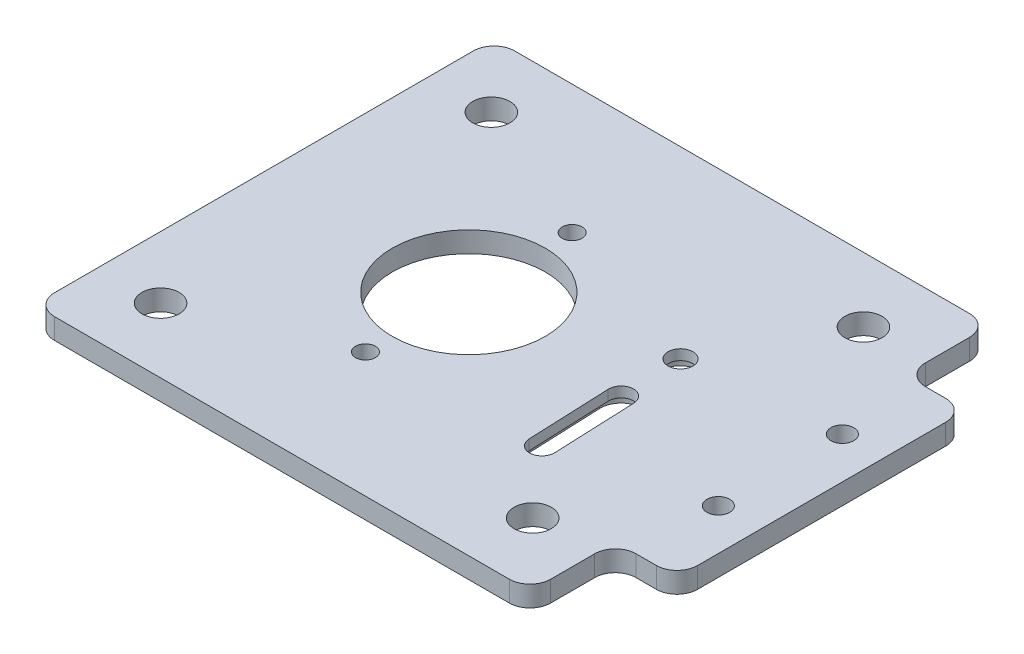
from build123d import *

# Parameters (mm, degrees)
SKETCH1_W            = 230
SKETCH1_H            = 200
BOSS_EXTRUDE1_DEPTH  = 5
SKETCH2_R            = 15
SKETCH2_R_2          = 14
SKETCH2_R_3          = 10
SKETCH2_R_4          = 18.5
SKETCH2_R_5          = 3
CUT_EXTRUDE1_DEPTH   = 305.836021494
M4_CLEARANCE_HOLE1_D = 4.8
SKETCH5_W            = 20
SKETCH5_H            = 5
CUT_EXTRUDE2_DEPTH   = 305.836021494
SKETCH8_W            = 230
SKETCH8_H            = 89.8
CUT_EXTRUDE4_DEPTH   = 305.836021494
SKETCH16_W           = 120
SKETCH16_H           = 1.1
BOSS_EXTRUDE2_DEPTH  = 5
M8_CLEARANCE_HOLE1_D = 9
CUT_EXTRUDE7_DEPTH   = 306.558848669
M5_CLEARANCE_HOLE2_D = 5.5
FILLET3_R            = 30
SKETCH22_W           = 97.742742711
SKETCH22_H           = 151.745417032
CUT_EXTRUDE8_DEPTH   = 281.162827656
SKETCH23_R           = 5
CUT_EXTRUDE9_DEPTH   = 2.5
FILLET4_R            = 5


with BuildPart() as part:
    # Sketch1 → Boss-Extrude1 (new body)
    with BuildSketch(Plane(origin=(0, 0, 0), x_dir=(1, 0, 0), z_dir=(0, 1, 0))):
        with Locations((115, 100)):
            Rectangle(SKETCH1_W, SKETCH1_H)
    extrude(amount=BOSS_EXTRUDE1_DEPTH)

    # Sketch2 → Cut-Extrude1 (cut, through all)
    with BuildSketch(Plane(origin=(0, 5, 0), x_dir=(1, 0, 0), z_dir=(0, 1, 0))):
        with Locations(Location((50, 60, 0), (0, 0, 270))):
            Circle(SKETCH2_R)
        with Locations(Location((168.717100706, 42.5, 0), (0, 0, 270))):
            Circle(SKETCH2_R_2)
        with Locations(Location((169.895788083, 150, 0), (0, 0, 90))):
            Circle(SKETCH2_R_3)
        with Locations(Location((50, 145, 0), (0, 0, 90))):
            Circle(SKETCH2_R_4)
        with Locations(Location((89.548596028, 156.65798234, 0), (0, 0, 270))):
            Circle(SKETCH2_R_5)
        with BuildLine():
            Line((104.360743639, 72.202850118), (98.527410306, 32.630483216))
            ThreePointArc((98.527410306, 32.630483216), (96.257125294, 30.943531537), (94.570173616, 33.213816549))
            Line((94.570173616, 33.213816549), (100.403506949, 72.786183451))
            ThreePointArc((100.403506949, 72.786183451), (102.673791961, 74.473135129), (104.360743639, 72.202850118))
        make_face()
        with BuildLine():
            Line((94.004324063, 121.813377483), (93.17099073, 141.79600883))
            ThreePointArc((93.17099073, 141.79600883), (90.048596028, 144.668403532), (87.176201326, 141.54600883))
            Line((87.176201326, 141.54600883), (88.009534659, 121.563377483))
            ThreePointArc((88.009534659, 121.563377483), (91.131929361, 118.690982781), (94.004324063, 121.813377483))
        make_face()
    extrude(amount=-CUT_EXTRUDE1_DEPTH, mode=Mode.SUBTRACT)

    # M4 Clearance Hole1 (through all)
    with Locations(Plane(origin=(0, 5, 0), x_dir=(1, 0, 0), z_dir=(0, 1, 0))):
        with Locations((50, 120), (50, 32.5), (168.717100706, 61), (168.717100706, 24), (187.217100706, 42.5), (150.217100706, 42.5), (50, 170)):
            Hole(M4_CLEARANCE_HOLE1_D / 2)

    # Sketch5 → Cut-Extrude2 (cut, through all)
    with BuildSketch(Plane(origin=(0, 5, 0), x_dir=(1, 0, 0), z_dir=(0, 1, 0))):
        with Locations((30, 7.5)):
            Rectangle(SKETCH5_W, SKETCH5_H)
        with Locations((70, 7.5)):
            Rectangle(SKETCH5_W, SKETCH5_H)
        with Locations((110, 7.5)):
            Rectangle(SKETCH5_W, SKETCH5_H)
        with Locations((150, 7.5)):
            Rectangle(SKETCH5_W, SKETCH5_H)
        with Locations((190, 7.5)):
            Rectangle(SKETCH5_W, SKETCH5_H)
    extrude(amount=-CUT_EXTRUDE2_DEPTH, mode=Mode.SUBTRACT)

    # Sketch8 → Cut-Extrude4 (cut, through all)
    with BuildSketch(Plane(origin=(0, 5, 0), x_dir=(1, 0, 0), z_dir=(0, 1, 0))):
        with Locations((115, 44.9)):
            Rectangle(SKETCH8_W, SKETCH8_H)
    extrude(amount=-CUT_EXTRUDE4_DEPTH, mode=Mode.SUBTRACT)

    # Sketch16 → Boss-Extrude2 (add)
    with BuildSketch(Plane(origin=(0, 5, 0), x_dir=(1, 0, 0), z_dir=(0, 1, 0))):
        with Locations((60, 200.55)):
            Rectangle(SKETCH16_W, SKETCH16_H)
    extrude(amount=-BOSS_EXTRUDE2_DEPTH)

    # M8 Clearance Hole1 (through all)
    with Locations(Plane(origin=(0, 5, 0), x_dir=(1, 0, 0), z_dir=(0, 1, 0))):
        with Locations((15, 185.45), (15, 105.45), (105, 105.45), (105, 185.45)):
            Hole(M8_CLEARANCE_HOLE1_D / 2)

    # Sketch18 → Cut-Extrude7 (cut, through all)
    with BuildSketch(Plane(origin=(0, 5, 0), x_dir=(1, 0, 0), z_dir=(0, 1, 0))):
        Polygon((120, 225.92357398), (254.211620271, 225.92357398), (254.211620271, 61.332744885), (120, 61.332744885), (120, 110.45), (195, 110.45), (195, 180.45), (120, 180.45), align=None)
    extrude(amount=-CUT_EXTRUDE7_DEPTH, mode=Mode.SUBTRACT)

    # M5 Clearance Hole2 (through all)
    with Locations(Plane(origin=(0, 5, 0), x_dir=(1, 0, 0), z_dir=(0, 1, 0))):
        with Locations((124.9, 160.45), (124.9, 130.45)):
            Hole(M5_CLEARANCE_HOLE2_D / 2)

    # Fillet3
    fillet3_edges = [part.edges().sort_by_distance(p)[0] for p in [
        (195, 2.5, -110.45),
        (195, 2.5, -180.45),
    ]]
    fillet(fillet3_edges, radius=FILLET3_R)

    # Sketch22 → Cut-Extrude8 (cut, through all)
    with BuildSketch(Plane(origin=(0, 5, 0), x_dir=(1, 0, 0), z_dir=(0, 1, 0))):
        with Locations((183.771371356, 144.05197651)):
            Rectangle(SKETCH22_W, SKETCH22_H)
    extrude(amount=-CUT_EXTRUDE8_DEPTH, mode=Mode.SUBTRACT)

    # Sketch23 → Cut-Extrude9 (cut)
    with BuildSketch(Plane.XZ):
        with Locations(Location((89.548596028, -156.65798234, 0), (0, 0, 270))):
            Circle(SKETCH23_R)
        with BuildLine():
            Line((95.169253864, -141.879342163), (96.002587198, -121.896710816))
            ThreePointArc((96.002587198, -121.896710816), (91.215262694, -116.692719646), (86.011271524, -121.480044149))
            Line((86.011271524, -121.480044149), (85.177938191, -141.462675497))
            ThreePointArc((85.177938191, -141.462675497), (89.965262694, -146.666666667), (95.169253864, -141.879342163))
        make_face()
    extrude(amount=-CUT_EXTRUDE9_DEPTH, mode=Mode.SUBTRACT)

    # Fillet4
    fillet4_edges = [part.edges().sort_by_distance(p)[0] for p in [
        (0, 2.5, -89.8),
        (120, 2.5, -201.1),
        (0, 2.5, -201.1),
        (120, 2.5, -89.8),
        (120, 2.5, -180.45),
        (120, 2.5, -110.45),
        (134.9, 2.5, -180.45),
        (134.9, 2.5, -110.45),
    ]]
    fillet(fillet4_edges, radius=FILLET4_R)


solid = part.part
